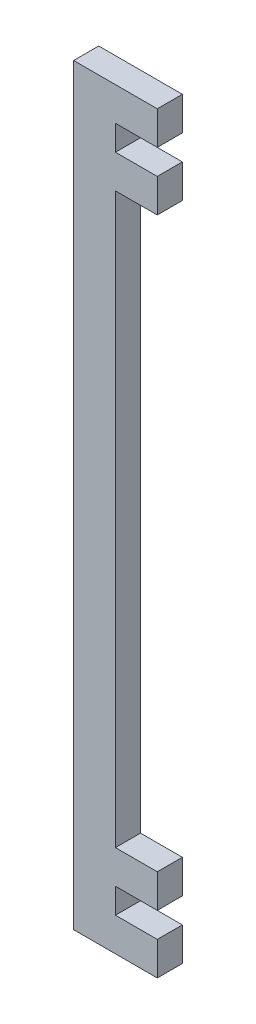
from build123d import *

# Parameters (mm, degrees)
EXTRUDE_1_DEPTH = 3


with BuildPart() as part:
    # 草图1 → 凸台-拉伸1 (new body)
    with BuildSketch(Plane.XY):
        Polygon((0, 0), (10, 0), (10, 4), (5, 4), (5, 7), (10, 7), (10, 11), (5, 11), (5, 79), (10, 79), (10, 83), (5, 83), (5, 86), (10, 86), (10, 90), (0, 90), align=None)
    extrude(amount=EXTRUDE_1_DEPTH)


solid = part.part
